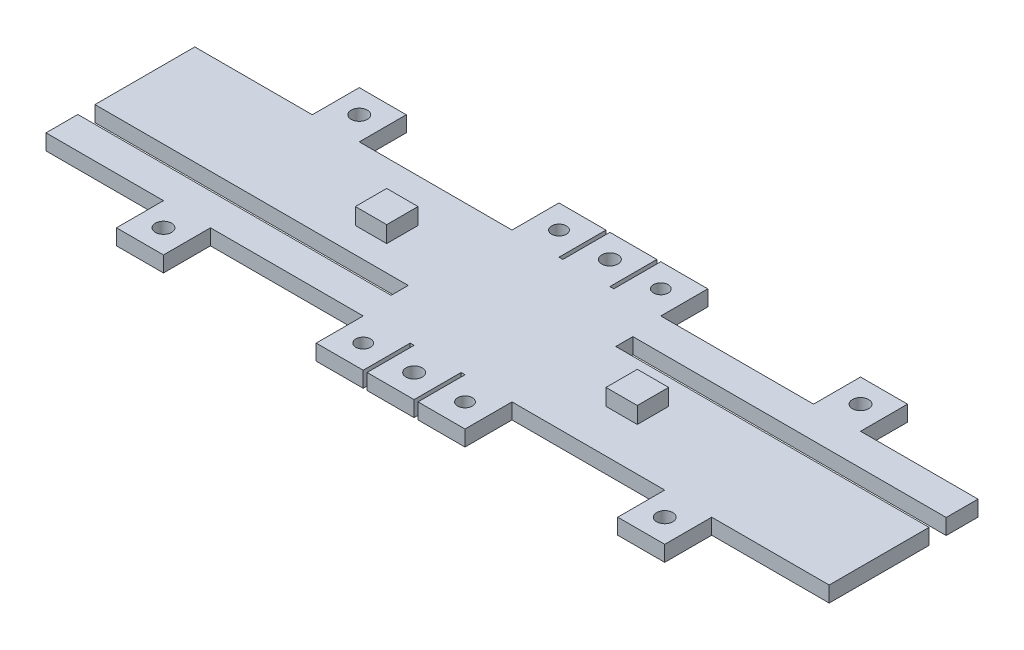
from build123d import *

# Parameters (mm, degrees)
SKETCH1_W           = 160
SKETCH1_H           = 30.4
BOSS_EXTRUDE1_DEPTH = 3.2
SKETCH2_W           = 9.6
SKETCH2_H           = 9.6
SKETCH2_R           = 1.65
BOSS_EXTRUDE2_DEPTH = 3.2
SKETCH3_W           = 64
SKETCH3_H           = 3.5
CUT_EXTRUDE1_DEPTH  = 165.955266663
SKETCH4_W           = 9.6
SKETCH4_H           = 9.6
SKETCH4_R           = 1.5
BOSS_EXTRUDE3_DEPTH = 3.2
SKETCH5_W           = 6.4
SKETCH5_H           = 6.4
BOSS_EXTRUDE4_DEPTH = 3.36


with BuildPart() as part:
    # Sketch1 → Boss-Extrude1 (new body)
    with BuildSketch(Plane(origin=(0, 0, 0), x_dir=(1, 0, 0), z_dir=(0, 1, 0))):
        with Locations((80, -15.2)):
            Rectangle(SKETCH1_W, SKETCH1_H)
    extrude(amount=BOSS_EXTRUDE1_DEPTH)

    # Sketch2 → Boss-Extrude2 (add)
    # profile 1 of 6: a face of its own
    with BuildSketch(Plane(origin=(0, 3.2, 0), x_dir=(1, 0, 0), z_dir=(0, 1, 0))):
        with Locations((28.8, -35.2)):
            Rectangle(SKETCH2_W, SKETCH2_H)
        with Locations(Location((28.8, -35.2, 0), (0, 0, 270))):
            Circle(SKETCH2_R, mode=Mode.SUBTRACT)
    # profile 2 of 6: a face of its own
    with BuildSketch(Plane(origin=(0, 3.2, 0), x_dir=(1, 0, 0), z_dir=(0, 1, 0))):
        with Locations((80, -35.2)):
            Rectangle(SKETCH2_W, SKETCH2_H)
        with Locations(Location((80, -35.2, 0), (0, 0, 270))):
            Circle(SKETCH2_R, mode=Mode.SUBTRACT)
    # profile 3 of 6: a face of its own
    with BuildSketch(Plane(origin=(0, 3.2, 0), x_dir=(1, 0, 0), z_dir=(0, 1, 0))):
        with Locations((131.2, -35.2)):
            Rectangle(SKETCH2_W, SKETCH2_H)
        with Locations(Location((131.2, -35.2, 0), (0, 0, 270))):
            Circle(SKETCH2_R, mode=Mode.SUBTRACT)
    # profile 4 of 6: a face of its own
    with BuildSketch(Plane(origin=(0, 3.2, 0), x_dir=(1, 0, 0), z_dir=(0, 1, 0))):
        with Locations((80, 4.8)):
            Rectangle(SKETCH2_W, SKETCH2_H)
        with Locations(Location((80, 4.8, 0), (0, 0, 270))):
            Circle(SKETCH2_R, mode=Mode.SUBTRACT)
    # profile 5 of 6: a face of its own
    with BuildSketch(Plane(origin=(0, 3.2, 0), x_dir=(1, 0, 0), z_dir=(0, 1, 0))):
        with Locations((131.2, 4.8)):
            Rectangle(SKETCH2_W, SKETCH2_H)
        with Locations(Location((131.2, 4.8, 0), (0, 0, 270))):
            Circle(SKETCH2_R, mode=Mode.SUBTRACT)
    # profile 6 of 6: a face of its own
    with BuildSketch(Plane(origin=(0, 3.2, 0), x_dir=(1, 0, 0), z_dir=(0, 1, 0))):
        with Locations((28.8, 4.8)):
            Rectangle(SKETCH2_W, SKETCH2_H)
        with Locations(Location((28.8, 4.8, 0), (0, 0, 270))):
            Circle(SKETCH2_R, mode=Mode.SUBTRACT)
    extrude(amount=-BOSS_EXTRUDE2_DEPTH)

    # Sketch3 → Cut-Extrude1 (cut, through all)
    with BuildSketch(Plane(origin=(0, 3.2, 0), x_dir=(1, 0, 0), z_dir=(0, 1, 0))):
        with Locations((32, -22.15)):
            Rectangle(SKETCH3_W, SKETCH3_H)
        with Locations((128, -8.25)):
            Rectangle(SKETCH3_W, SKETCH3_H)
    extrude(amount=-CUT_EXTRUDE1_DEPTH, mode=Mode.SUBTRACT)

    # Sketch4 → Boss-Extrude3 (add)
    # profile 1 of 4: a face of its own
    with BuildSketch(Plane(origin=(0, 3.2, 0), x_dir=(1, 0, 0), z_dir=(0, 1, 0))):
        with Locations((69.6, -35.2)):
            Rectangle(SKETCH4_W, SKETCH4_H)
        with Locations(Location((69.6, -35.2, 0), (0, 0, 270))):
            Circle(SKETCH4_R, mode=Mode.SUBTRACT)
    # profile 2 of 4: a face of its own
    with BuildSketch(Plane(origin=(0, 3.2, 0), x_dir=(1, 0, 0), z_dir=(0, 1, 0))):
        with Locations((90.4, -35.2)):
            Rectangle(SKETCH4_W, SKETCH4_H)
        with Locations(Location((90.4, -35.2, 0), (0, 0, 270))):
            Circle(SKETCH4_R, mode=Mode.SUBTRACT)
    # profile 3 of 4: a face of its own
    with BuildSketch(Plane(origin=(0, 3.2, 0), x_dir=(1, 0, 0), z_dir=(0, 1, 0))):
        with Locations((90.4, 4.8)):
            Rectangle(SKETCH4_W, SKETCH4_H)
        with Locations(Location((90.4, 4.8, 0), (0, 0, 90))):
            Circle(SKETCH4_R, mode=Mode.SUBTRACT)
    # profile 4 of 4: a face of its own
    with BuildSketch(Plane(origin=(0, 3.2, 0), x_dir=(1, 0, 0), z_dir=(0, 1, 0))):
        with Locations((69.6, 4.8)):
            Rectangle(SKETCH4_W, SKETCH4_H)
        with Locations(Location((69.6, 4.8, 0), (0, 0, 90))):
            Circle(SKETCH4_R, mode=Mode.SUBTRACT)
    extrude(amount=-BOSS_EXTRUDE3_DEPTH)

    # Sketch5 → Boss-Extrude4 (add)
    with BuildSketch(Plane(origin=(0, 3.2, 0), x_dir=(1, 0, 0), z_dir=(0, 1, 0))):
        with Locations((51.2, -12)):
            Rectangle(SKETCH5_W, SKETCH5_H)
        with Locations((108.8, -18.4)):
            Rectangle(SKETCH5_W, SKETCH5_H)
    extrude(amount=BOSS_EXTRUDE4_DEPTH)


solid = part.part
